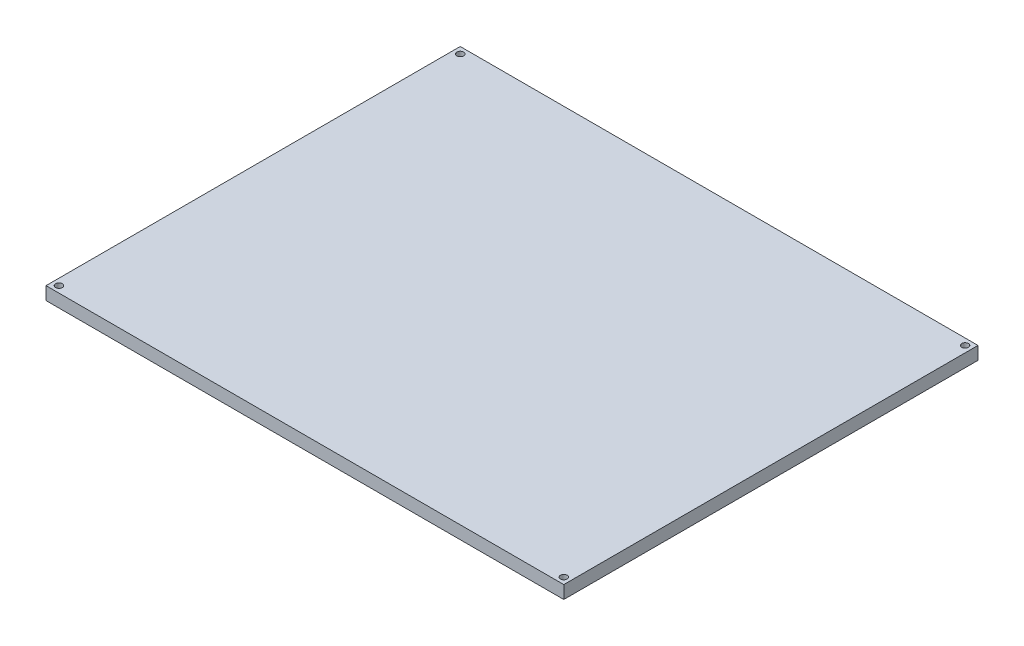
from build123d import *

# Parameters (mm, degrees)
SKETCH1_W           = 254
SKETCH1_H           = 203.2
BOSS_EXTRUDE1_DEPTH = 6.35
SKETCH3_R           = 1.65
CUT_EXTRUDE1_DEPTH  = 163.763271348


with BuildPart() as part:
    # Sketch1 → Boss-Extrude1 (new body)
    with BuildSketch(Plane(origin=(0, 0, 0), x_dir=(1, 0, 0), z_dir=(0, 1, 0))):
        Rectangle(SKETCH1_W, SKETCH1_H)
    extrude(amount=BOSS_EXTRUDE1_DEPTH)

    # Sketch3 → Cut-Extrude1 (cut, through all)
    with BuildSketch(Plane(origin=(0, 6.35, 0), x_dir=(1, 0, 0), z_dir=(0, 1, 0))):
        with Locations(Location((123.825, 98.425, 0), (0, 0, 270))):
            Circle(SKETCH3_R)
        with Locations(Location((123.825, -98.425, 0), (0, 0, 270))):
            Circle(SKETCH3_R)
        with Locations(Location((-123.825, -98.425, 0), (0, 0, 270))):
            Circle(SKETCH3_R)
        with Locations(Location((-123.825, 98.425, 0), (0, 0, 270))):
            Circle(SKETCH3_R)
    extrude(amount=-CUT_EXTRUDE1_DEPTH, mode=Mode.SUBTRACT)


solid = part.part
